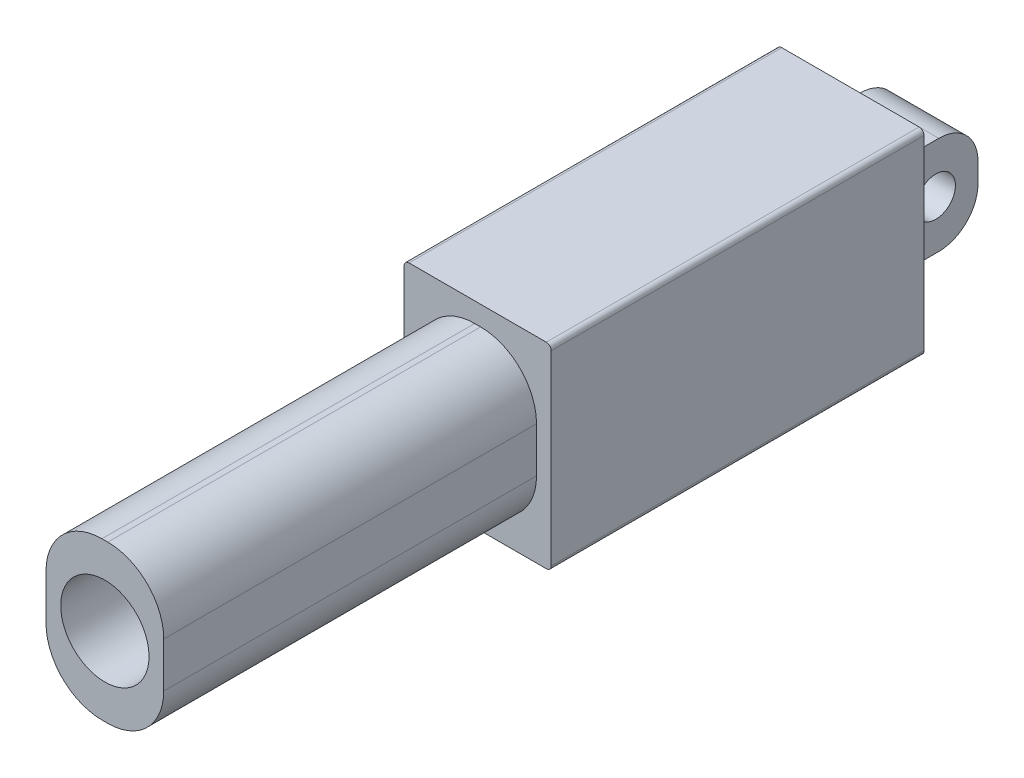
from build123d import *

# Parameters (mm, degrees)
SKETCH_1_W          = 15
SKETCH_1_H          = 20
EXTRUDE_1_DEPTH     = 38
EXTRUDE_2_DEPTH     = 38
SKETCH_3_W          = 8
SKETCH_3_H          = 10
EXTRUDE_3_DEPTH     = 9
FILLET_1_R          = 4
SKETCH_4_R          = 2
CUT_EXTRUDE_1_DEPTH = 78.512902152
FILLET_2_R          = 0.5
SKETCH_5_R          = 4.5
CUT_EXTRUDE_2_DEPTH = 35


with BuildPart() as part:
    # Эскиз1 → Бобышка-Вытянуть1 (new body)
    with BuildSketch(Plane.XY):
        Rectangle(SKETCH_1_W, SKETCH_1_H)
    extrude(amount=EXTRUDE_1_DEPTH)

    # Эскиз2 → Бобышка-Вытянуть2 (add)
    with BuildSketch(Plane.XY.offset(38)):
        with BuildLine():
            Line((0.3, -8), (-0.3, -8))
            ThreePointArc((-0.3, -8), (-4.330508653, -6.330508653), (-6, -2.3))
            Line((-6, -2.3), (-6, 2.3))
            ThreePointArc((-6, 2.3), (-4.330508653, 6.330508653), (-0.3, 8))
            Line((-0.3, 8), (0.3, 8))
            ThreePointArc((0.3, 8), (4.330508653, 6.330508653), (6, 2.3))
            Line((6, 2.3), (6, -2.3))
            ThreePointArc((6, -2.3), (4.330508653, -6.330508653), (0.3, -8))
        make_face()
    extrude(amount=EXTRUDE_2_DEPTH)

    # Эскиз3 → Бобышка-Вытянуть3 (add)
    with BuildSketch(Plane(origin=(0, 0, 0), x_dir=(-1, 0, 0), z_dir=(0, 0, -1))):
        Rectangle(SKETCH_3_W, SKETCH_3_H)
    extrude(amount=EXTRUDE_3_DEPTH)

    # Скругление1
    fillet_1_edges = [part.edges().sort_by_distance(p)[0] for p in [
        (0, 5, -9),
        (0, -5, -9),
    ]]
    fillet(fillet_1_edges, radius=FILLET_1_R)

    # Эскиз4 → Вырез-Вытянуть1 (cut, through all)
    with BuildSketch(Plane.ZY.offset(4)):
        with Locations((-4.7, 0)):
            Circle(SKETCH_4_R)
    extrude(amount=-CUT_EXTRUDE_1_DEPTH, mode=Mode.SUBTRACT)

    # Скругление2
    fillet_2_edges = [part.edges().sort_by_distance(p)[0] for p in [
        (-7.5, 10, 19),
        (7.5, 10, 19),
        (7.5, -10, 19),
        (-7.5, -10, 19),
    ]]
    fillet(fillet_2_edges, radius=FILLET_2_R)

    # Эскиз5 → Вырез-Вытянуть2 (cut)
    with BuildSketch(Plane.XY.offset(76)):
        Circle(SKETCH_5_R)
    extrude(amount=-CUT_EXTRUDE_2_DEPTH, mode=Mode.SUBTRACT)


solid = part.part
